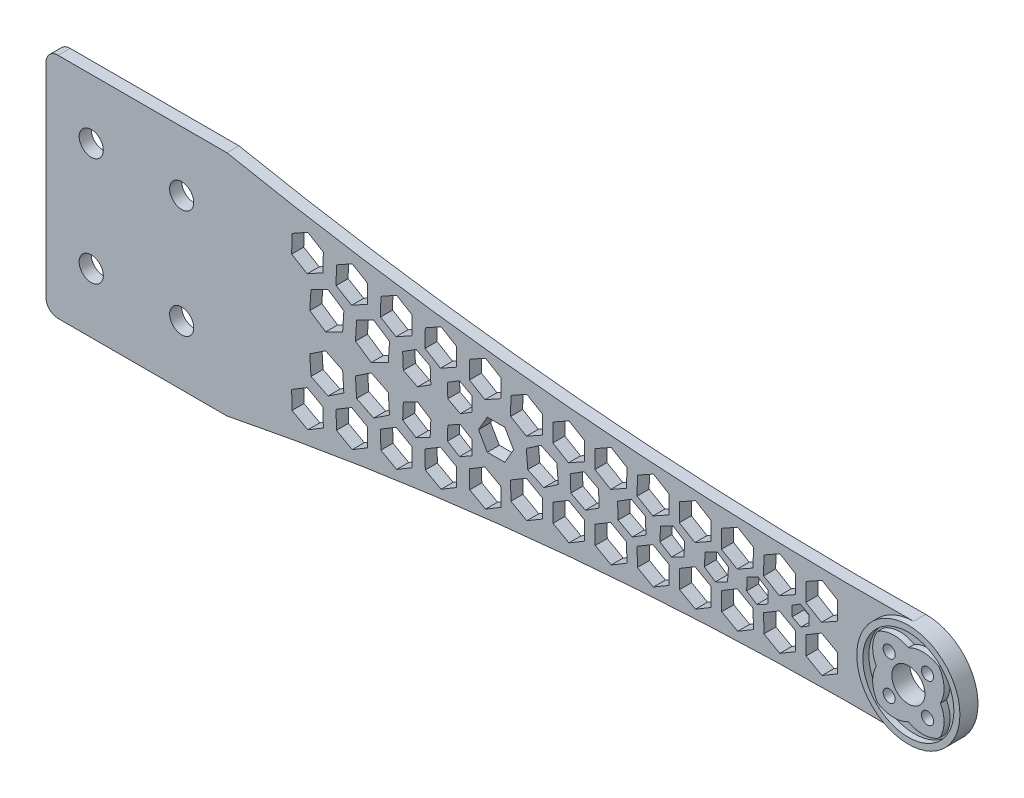
from build123d import *

# Parameters (mm, degrees)
BOSS_EXTRUDE1_DEPTH = 2
SKETCH2_R           = 8.55
SKETCH2_R_2         = 7.55
SKETCH2_R_3         = 2.75
BOSS_EXTRUDE2_DEPTH = 1
SKETCH2_3_R         = 1
SKETCH2_3_R_2       = 2.75
CUT_EXTRUDE1_DEPTH  = 125.014668744
SKETCH4_W           = 30
SKETCH4_H           = 37.796061368
BOSS_EXTRUDE5_DEPTH = 2
SKETCH5_R           = 2
CUT_EXTRUDE2_DEPTH  = 125.014668744
FILLET1_R           = 2


with BuildPart() as part:
    # Sketch1 → Boss-Extrude1 (new body)
    with BuildSketch(Plane.XY):
        with BuildLine():
            ThreePointArc((113.870246671, 8.549015386), (56.661105929, 10.708508681), (0, 18.898030684))
            Line((0, 18.898030684), (0, -18.898030684))
            ThreePointArc((0, -18.898030684), (56.661105929, -10.708508681), (113.870246671, -8.549015386))
            ThreePointArc((113.870246671, -8.549015386), (122.55, 0), (113.870246671, 8.549015386))
        make_face()
        Polygon((10.739570687, -9.718861492), (13.312049464, -8.175374226), (15.934988035, -9.631462564), (15.98544783, -12.631038169), (13.412969053, -14.174525436), (10.790030481, -12.718437097), align=None, mode=Mode.SUBTRACT)
        Polygon((20.781290821, -13.339093448), (18.158352249, -11.88300511), (18.107892455, -8.883429505), (20.680371232, -7.339942239), (23.303309804, -8.796030577), (23.353769598, -11.795606182), align=None, mode=Mode.SUBTRACT)
        Polygon((28.149612589, -12.503661461), (25.526674017, -11.047573123), (25.476214223, -8.047997518), (28.048693, -6.504510251), (30.671631572, -7.96059859), (30.722091366, -10.960174195), align=None, mode=Mode.SUBTRACT)
        Polygon((13.740996159, -3.105313097), (16.36673573, -1.359706758), (19.191344951, -2.760860761), (19.3902146, -5.907621103), (16.764475029, -7.653227442), (13.939865808, -6.25207344), align=None, mode=Mode.SUBTRACT)
        Polygon((26.762364413, -2.142698495), (26.961234063, -5.289458837), (24.335494492, -7.035065176), (21.510885271, -5.633911174), (21.312015622, -2.487150832), (23.937755193, -0.741544492), align=None, mode=Mode.SUBTRACT)
        Polygon((35.517934357, -11.668229474), (32.894995785, -10.212141135), (32.844535991, -7.21256553), (35.417014768, -5.669078264), (38.03995334, -7.125166603), (38.090413134, -10.124742208), align=None, mode=Mode.SUBTRACT)
        Polygon((42.886256125, -10.832797487), (40.263317553, -9.376709148), (40.212857759, -6.377133543), (42.785336536, -4.833646277), (45.408275108, -6.289734615), (45.458734902, -9.28931022), align=None, mode=Mode.SUBTRACT)
        Polygon((47.047475096, -4.566203317), (49.652539452, -3.016564588), (52.297098136, -4.497797134), (52.336592464, -7.528668409), (49.731528108, -9.078307138), (47.086969425, -7.597074592), align=None, mode=Mode.SUBTRACT)
        Polygon((54.040114072, -4.24526694), (56.645178428, -2.695628211), (59.289737112, -4.176860757), (59.32923144, -7.207732032), (56.724167084, -8.757370761), (54.0796084, -7.276138215), align=None, mode=Mode.SUBTRACT)
        Polygon((33.702919314, -5.121351698), (31.364020458, -6.338661778), (29.140349577, -4.921770993), (29.25557755, -2.287570127), (31.594476405, -1.070260046), (33.818147287, -2.487150832), align=None, mode=Mode.SUBTRACT)
        Polygon((36.571322265, -4.222832826), (36.631219773, -1.884047842), (38.686615737, -0.766528114), (40.682114193, -1.987793369), (40.622216685, -4.326578353), (38.566820721, -5.444098081), align=None, mode=Mode.SUBTRACT)
        Polygon((46.084534155, 2.518579159), (47.538636511, 0), (46.084534155, -2.518579159), (43.176329444, -2.518579159), (41.722227089, 0), (43.176329444, 2.518579159), align=None, mode=Mode.SUBTRACT)
        Polygon((54.712942948, 1.665786798), (54.947634227, -1.25928958), (52.531789415, -2.925076378), (49.881253324, -1.665786798), (49.646562045, 1.25928958), (52.062406857, 2.925076378), align=None, mode=Mode.SUBTRACT)
        Polygon((61.621915096, 1.452465419), (61.733445219, -1.25928958), (59.440761563, -2.711754999), (57.036547784, -1.452465419), (56.925017661, 1.25928958), (59.217701317, 2.711754999), align=None, mode=Mode.SUBTRACT)
        Polygon((61.032753047, -3.924330563), (63.637817403, -2.374691834), (66.282376087, -3.85592438), (66.321870415, -6.886795655), (63.716806059, -8.436434385), (61.072247376, -6.955201838), align=None, mode=Mode.SUBTRACT)
        Polygon((68.025392023, -3.603394186), (70.630456379, -2.053755457), (73.275015063, -3.534988003), (73.314509391, -6.565859279), (70.709445035, -8.115498008), (68.064886351, -6.634265461), align=None, mode=Mode.SUBTRACT)
        Polygon((75.018030998, -3.282457809), (77.623095354, -1.73281908), (80.267654038, -3.214051626), (80.307148366, -6.244922902), (77.702084011, -7.794561631), (75.057525327, -6.313329085), align=None, mode=Mode.SUBTRACT)
        Polygon((69.40210407, 1.409205006), (69.488657781, -1.25928958), (67.220950537, -2.668494585), (64.86668958, -1.409205006), (64.780135869, 1.25928958), (67.047843113, 2.668494585), align=None, mode=Mode.SUBTRACT)
        Polygon((75.910943185, 1.049407983), (75.789767988, -1.25928958), (73.729789652, -2.308697562), (71.790986511, -1.049407983), (71.912161707, 1.25928958), (73.972140044, 2.308697562), align=None, mode=Mode.SUBTRACT)
        Polygon((82.010669974, -2.961521432), (84.61573433, -1.411882703), (87.260293014, -2.893115249), (87.299787342, -5.923986525), (84.694722986, -7.473625254), (82.050164302, -5.992392708), align=None, mode=Mode.SUBTRACT)
        Polygon((89.042803278, -5.671456331), (89.003308949, -2.640585055), (91.608373305, -1.090946326), (94.252931989, -2.572178873), (94.292426317, -5.603050148), (91.687361962, -7.152688877), align=None, mode=Mode.SUBTRACT)
        Polygon((83.172610263, 0.963691445), (83.0019466, -1.25928958), (80.991456729, -2.222981025), (79.151630521, -0.963691445), (79.322294184, 1.25928958), (81.332784054, 2.222981025), align=None, mode=Mode.SUBTRACT)
        Polygon((89.772850159, 0.929838165), (89.679834319, -1.090946326), (87.883275693, -2.020784492), (86.179732908, -0.929838165), (86.272748748, 1.090946326), (88.069307374, 2.020784492), align=None, mode=Mode.SUBTRACT)
        Polygon((96.035442253, -5.350519954), (95.995947925, -2.319648678), (98.601012281, -0.770009949), (101.245570965, -2.251242496), (101.285065293, -5.282113771), (98.680000937, -6.8317525), align=None, mode=Mode.SUBTRACT)
        Polygon((19.3902146, 5.907621103), (19.191344951, 2.760860761), (16.36673573, 1.359706758), (13.740996159, 3.105313097), (13.939865808, 6.25207344), (16.764475029, 7.653227442), align=None, mode=Mode.SUBTRACT)
        Polygon((21.510885271, 5.633911174), (24.335494492, 7.035065176), (26.961234063, 5.289458837), (26.762364413, 2.142698495), (23.937755193, 0.741544492), (21.312015622, 2.487150832), align=None, mode=Mode.SUBTRACT)
        Polygon((31.364020458, 6.338661778), (33.702919314, 5.121351698), (33.818147287, 2.487150832), (31.594476405, 1.070260046), (29.25557755, 2.287570127), (29.140349577, 4.921770993), align=None, mode=Mode.SUBTRACT)
        Polygon((36.571322265, 4.222832826), (38.566820721, 5.444098081), (40.622216685, 4.326578353), (40.682114193, 1.987793369), (38.686615737, 0.766528114), (36.631219773, 1.884047842), align=None, mode=Mode.SUBTRACT)
        Polygon((32.894995785, 10.212141135), (35.517934357, 11.668229474), (38.090413134, 10.124742208), (38.03995334, 7.125166603), (35.417014768, 5.669078264), (32.844535991, 7.21256553), align=None, mode=Mode.SUBTRACT)
        Polygon((40.263317553, 9.376709148), (42.886256125, 10.832797487), (45.458734902, 9.28931022), (45.408275108, 6.289734615), (42.785336536, 4.833646277), (40.212857759, 6.377133543), align=None, mode=Mode.SUBTRACT)
        Polygon((52.336592464, 7.528668409), (52.297098136, 4.497797134), (49.652539452, 3.016564588), (47.047475096, 4.566203317), (47.086969425, 7.597074592), (49.731528108, 9.078307138), align=None, mode=Mode.SUBTRACT)
        Polygon((59.32923144, 7.207732032), (59.289737112, 4.176860757), (56.645178428, 2.695628211), (54.040114072, 4.24526694), (54.0796084, 7.276138215), (56.724167084, 8.757370761), align=None, mode=Mode.SUBTRACT)
        Polygon((15.98544783, 12.631038169), (15.934988035, 9.631462564), (13.312049464, 8.175374226), (10.739570687, 9.718861492), (10.790030481, 12.718437097), (13.412969053, 14.174525436), align=None, mode=Mode.SUBTRACT)
        Polygon((18.158352249, 11.88300511), (20.781290821, 13.339093448), (23.353769598, 11.795606182), (23.303309804, 8.796030577), (20.680371232, 7.339942239), (18.107892455, 8.883429505), align=None, mode=Mode.SUBTRACT)
        Polygon((25.526674017, 11.047573123), (28.149612589, 12.503661461), (30.722091366, 10.960174195), (30.671631572, 7.96059859), (28.048693, 6.504510251), (25.476214223, 8.047997518), align=None, mode=Mode.SUBTRACT)
        Polygon((87.299787342, 5.923986525), (87.260293014, 2.893115249), (84.61573433, 1.411882703), (82.010669974, 2.961521432), (82.050164302, 5.992392708), (84.694722986, 7.473625254), align=None, mode=Mode.SUBTRACT)
        Polygon((94.292426317, 5.603050148), (94.252931989, 2.572178873), (91.608373305, 1.090946326), (89.003308949, 2.640585055), (89.042803278, 5.671456331), (91.687361962, 7.152688877), align=None, mode=Mode.SUBTRACT)
        Polygon((66.321870415, 6.886795655), (66.282376087, 3.85592438), (63.637817403, 2.374691834), (61.032753047, 3.924330563), (61.072247376, 6.955201838), (63.716806059, 8.436434385), align=None, mode=Mode.SUBTRACT)
        Polygon((73.314509391, 6.565859279), (73.275015063, 3.534988003), (70.630456379, 2.053755457), (68.025392023, 3.603394186), (68.064886351, 6.634265461), (70.709445035, 8.115498008), align=None, mode=Mode.SUBTRACT)
        Polygon((80.307148366, 6.244922902), (80.267654038, 3.214051626), (77.623095354, 1.73281908), (75.018030998, 3.282457809), (75.057525327, 6.313329085), (77.702084011, 7.794561631), align=None, mode=Mode.SUBTRACT)
        Polygon((96.513507379, 0.854256541), (96.562147172, -0.770009949), (95.179811025, -1.624266491), (93.748835085, -0.854256541), (93.700195292, 0.770009949), (95.08253144, 1.624266491), align=None, mode=Mode.SUBTRACT)
        Polygon((101.285065293, 5.282113771), (101.245570965, 2.251242496), (98.601012281, 0.770009949), (95.995947925, 2.319648678), (96.035442253, 5.350519954), (98.680000937, 6.8317525), align=None, mode=Mode.SUBTRACT)
    extrude(amount=BOSS_EXTRUDE1_DEPTH)

    # Sketch2 → Boss-Extrude2 (add)
    # profile 1 of 6: a face of its own
    with BuildSketch(Plane.XY.offset(2)):
        with Locations(Location((114, 0, 0), (0, 0, 90.86954427))):
            Circle(SKETCH2_R)
        with Locations((114, 0)):
            Circle(SKETCH2_R_2, mode=Mode.SUBTRACT)
    # profile 2 of 6: a face of its own
    with BuildSketch(Plane.XY.offset(2)):
        with BuildLine():
            ThreePointArc((111.196632542, -2.253637259), (109.743084275, -1.345579703), (108.681582342, 0))
            ThreePointArc((108.681582342, 0), (108.084000654, -2.583204139), (108.891245898, -5.108754102))
            ThreePointArc((108.891245898, -5.108754102), (111.416795861, -5.915999346), (114, -5.318417658))
            ThreePointArc((114, -5.318417658), (112.654420297, -4.256915725), (111.746362741, -2.803367458))
            ThreePointArc((111.746362741, -2.803367458), (111.801418041, -2.988118189), (111.82, -3.18))
            ThreePointArc((111.82, -3.18), (109.990351719, -3.738286422), (111.196632542, -2.253637259))
        make_face()
    # profile 3 of 6: a face of its own
    with BuildSketch(Plane.XY.offset(2)):
        with BuildLine():
            ThreePointArc((111.746362741, 2.803367458), (111.527106781, 2.472893219), (111.196632542, 2.253637259))
            ThreePointArc((111.196632542, 2.253637259), (109.743084275, 1.345579703), (108.681582342, 0))
            ThreePointArc((108.681582342, 0), (109.743084275, -1.345579703), (111.196632542, -2.253637259))
            ThreePointArc((111.196632542, -2.253637259), (111.527106781, -2.472893219), (111.746362741, -2.803367458))
            ThreePointArc((111.746362741, -2.803367458), (112.654420297, -4.256915725), (114, -5.318417658))
            ThreePointArc((114, -5.318417658), (115.345579703, -4.256915725), (116.253637259, -2.803367458))
            ThreePointArc((116.253637259, -2.803367458), (116.472893219, -2.472893219), (116.803367458, -2.253637259))
            ThreePointArc((116.803367458, -2.253637259), (118.256915725, -1.345579703), (119.318417658, 0))
            ThreePointArc((119.318417658, 0), (118.256915725, 1.345579703), (116.803367458, 2.253637259))
            ThreePointArc((116.803367458, 2.253637259), (116.472893219, 2.472893219), (116.253637259, 2.803367458))
            ThreePointArc((116.253637259, 2.803367458), (115.345579703, 4.256915725), (114, 5.318417658))
            ThreePointArc((114, 5.318417658), (112.654420297, 4.256915725), (111.746362741, 2.803367458))
        make_face()
        with Locations((114, 0)):
            Circle(SKETCH2_R_3, mode=Mode.SUBTRACT)
    # profile 4 of 6: a face of its own
    with BuildSketch(Plane.XY.offset(2)):
        with BuildLine():
            ThreePointArc((111.196632542, 2.253637259), (109.990351719, 3.738286422), (111.82, 3.18))
            ThreePointArc((111.82, 3.18), (111.801418041, 2.988118189), (111.746362741, 2.803367458))
            ThreePointArc((111.746362741, 2.803367458), (112.654420297, 4.256915725), (114, 5.318417658))
            ThreePointArc((114, 5.318417658), (111.416795861, 5.915999346), (108.891245898, 5.108754102))
            ThreePointArc((108.891245898, 5.108754102), (108.084000654, 2.583204139), (108.681582342, 0))
            ThreePointArc((108.681582342, 0), (109.743084275, 1.345579703), (111.196632542, 2.253637259))
        make_face()
    # profile 5 of 6: a face of its own
    with BuildSketch(Plane.XY.offset(2)):
        with BuildLine():
            ThreePointArc((119.108754102, 5.108754102), (116.583204139, 5.915999346), (114, 5.318417658))
            ThreePointArc((114, 5.318417658), (115.345579703, 4.256915725), (116.253637259, 2.803367458))
            ThreePointArc((116.253637259, 2.803367458), (116.988118189, 4.161418041), (118.18, 3.18))
            ThreePointArc((118.18, 3.18), (117.738286422, 2.350351719), (116.803367458, 2.253637259))
            ThreePointArc((116.803367458, 2.253637259), (118.256915725, 1.345579703), (119.318417658, 0))
            ThreePointArc((119.318417658, 0), (119.915999346, 2.583204139), (119.108754102, 5.108754102))
        make_face()
    # profile 6 of 6: a face of its own
    with BuildSketch(Plane.XY.offset(2)):
        with BuildLine():
            ThreePointArc((116.253637259, -2.803367458), (115.345579703, -4.256915725), (114, -5.318417658))
            ThreePointArc((114, -5.318417658), (116.583204139, -5.915999346), (119.108754102, -5.108754102))
            ThreePointArc((119.108754102, -5.108754102), (119.915999346, -2.583204139), (119.318417658, 0))
            ThreePointArc((119.318417658, 0), (118.256915725, -1.345579703), (116.803367458, -2.253637259))
            ThreePointArc((116.803367458, -2.253637259), (117.738286422, -2.350351719), (118.18, -3.18))
            ThreePointArc((118.18, -3.18), (116.988118189, -4.161418041), (116.253637259, -2.803367458))
        make_face()
    extrude(amount=BOSS_EXTRUDE2_DEPTH)

    # Sketch2<3> → Cut-Extrude1 (cut, through all)
    with BuildSketch(Plane.XY.offset(2)):
        with Locations((117.18, -3.18)):
            Circle(SKETCH2_3_R)
        with Locations((117.18, 3.18)):
            Circle(SKETCH2_3_R)
        with Locations((110.82, 3.18)):
            Circle(SKETCH2_3_R)
        with Locations((110.82, -3.18)):
            Circle(SKETCH2_3_R)
        with Locations((114, 0)):
            Circle(SKETCH2_3_R_2)
    extrude(amount=-CUT_EXTRUDE1_DEPTH, mode=Mode.SUBTRACT)

    # Sketch4 → Boss-Extrude5 (add)
    with BuildSketch(Plane.XY.offset(2)):
        with Locations((-15, 0)):
            Rectangle(SKETCH4_W, SKETCH4_H)
    extrude(amount=-BOSS_EXTRUDE5_DEPTH)

    # Sketch5 → Cut-Extrude2 (cut, through all)
    with BuildSketch(Plane.XY.offset(2)):
        with Locations((-22.5, 9)):
            Circle(SKETCH5_R)
        with Locations((-7.5, 9)):
            Circle(SKETCH5_R)
        with Locations(Location((-7.5, -9, 0), (0, 0, 180))):
            Circle(SKETCH5_R)
        with Locations(Location((-22.5, -9, 0), (0, 0, 180))):
            Circle(SKETCH5_R)
    extrude(amount=-CUT_EXTRUDE2_DEPTH, mode=Mode.SUBTRACT)

    # Fillet1
    fillet1_edges = [part.edges().sort_by_distance(p)[0] for p in [
        (-30, -18.898030684, 1),
        (-30, 18.898030684, 1),
    ]]
    fillet(fillet1_edges, radius=FILLET1_R)


solid = part.part
